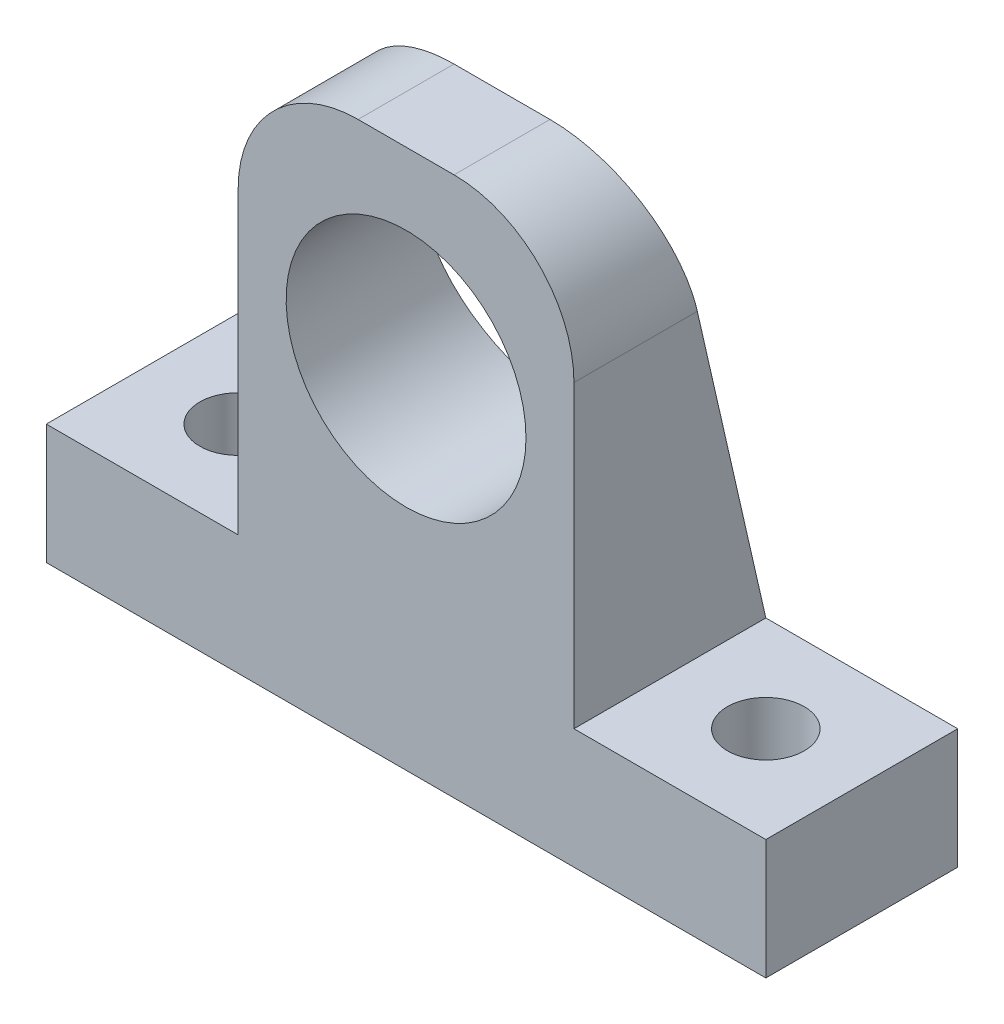
from build123d import *

# Parameters (mm, degrees)
SKETCH1_R               = 5
BOSS_EXTRUDE1_DEPTH     = 8
SKETCH2_R               = 1.6
CUT_EXTRUDE1_DEPTH      = 10
CUT_EXTRUDE2_DEPTH      = 39.34383914
CUT_EXTRUDE2_DEPTH_BACK = 39.34383914


with BuildPart() as part:
    # Sketch1 → Boss-Extrude1 (new body)
    with BuildSketch(Plane.XY):
        with BuildLine():
            Line((0, 0), (-15, 0))
            Line((-15, 0), (-15, 5))
            Line((-15, 5), (-7, 5))
            Line((-7, 5), (-7, 17.5))
            ThreePointArc((-7, 17.5), (-5.535533906, 21.035533906), (-2, 22.5))
            Line((-2, 22.5), (2, 22.5))
            ThreePointArc((2, 22.5), (5.535533906, 21.035533906), (7, 17.5))
            Line((7, 17.5), (7, 5))
            Line((7, 5), (15, 5))
            Line((15, 5), (15, 0))
            Line((15, 0), (0, 0))
        make_face()
        with Locations((0, 14.5)):
            Circle(SKETCH1_R, mode=Mode.SUBTRACT)
    extrude(amount=BOSS_EXTRUDE1_DEPTH)

    # Sketch2 → Cut-Extrude1 (cut)
    with BuildSketch(Plane(origin=(0, 5, 0), x_dir=(1, 0, 0), z_dir=(0, 1, 0))):
        with Locations(Location((-11, -4, 0), (0, 0, 270))):
            Circle(SKETCH2_R)
        with Locations(Location((11, -4, 0), (0, 0, 180))):
            Circle(SKETCH2_R)
    extrude(amount=-CUT_EXTRUDE1_DEPTH, mode=Mode.SUBTRACT)

    # Sketch3 → Cut-Extrude2 (cut, two sides: drawn at the far end of the back side and taken through both)
    with BuildSketch(Plane.ZY.offset(15).offset(-CUT_EXTRUDE2_DEPTH_BACK)):
        Polygon((-12.412584701, -49.305058066), (0, 5), (4, 22.5), (16.412584701, 76.805058066), (-92.197531432, 101.630227468), (-121.022700834, -24.479888665), align=None)
    extrude(amount=CUT_EXTRUDE2_DEPTH + CUT_EXTRUDE2_DEPTH_BACK, mode=Mode.SUBTRACT)


solid = part.part
